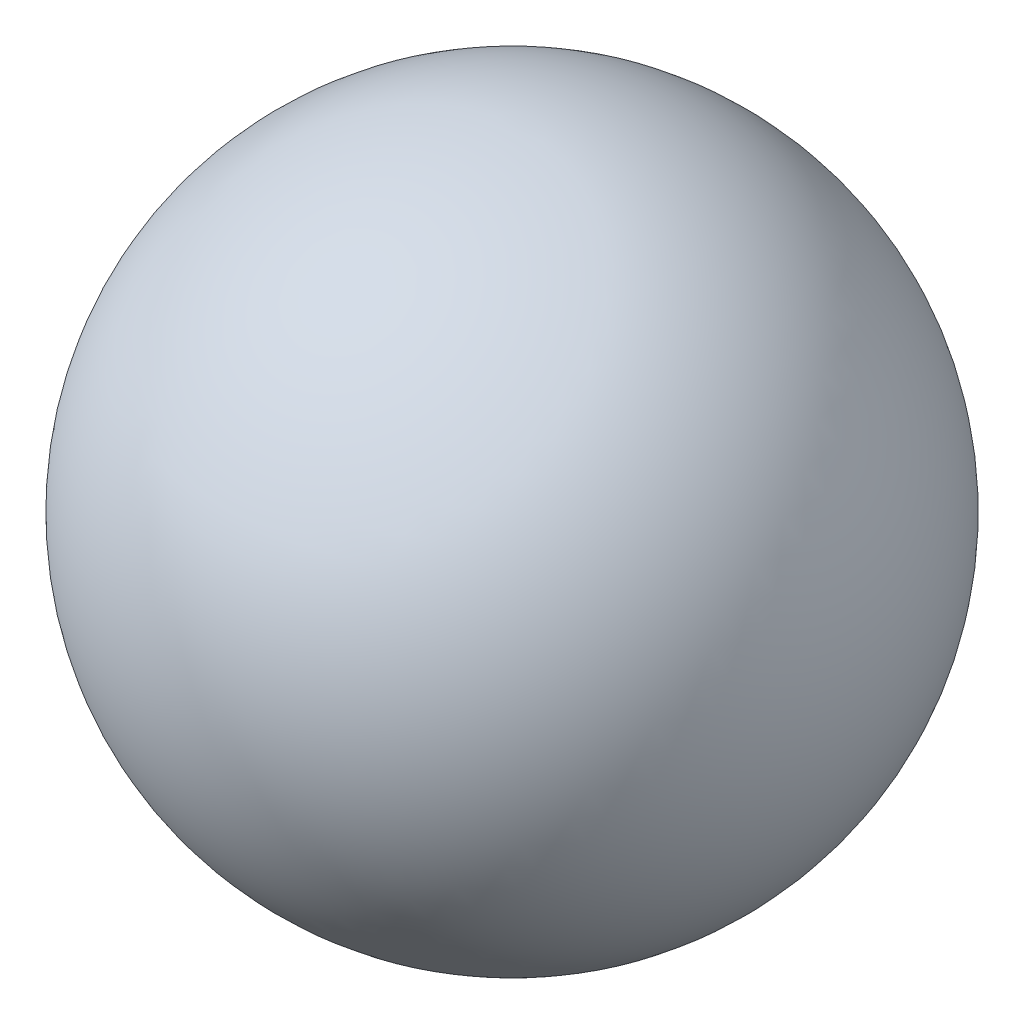
from build123d import *


with BuildPart() as part:
    # Çizim1 → Döndür1 (revolve)
    with BuildSketch(Plane.XY):
        with BuildLine():
            Line((0, 32.5), (0, -32.5))
            ThreePointArc((0, -32.5), (-32.5, 0), (0, 32.5))
        make_face()
    revolve(axis=Axis((0, 32.5, 0), (0, -1, 0)))


solid = part.part
